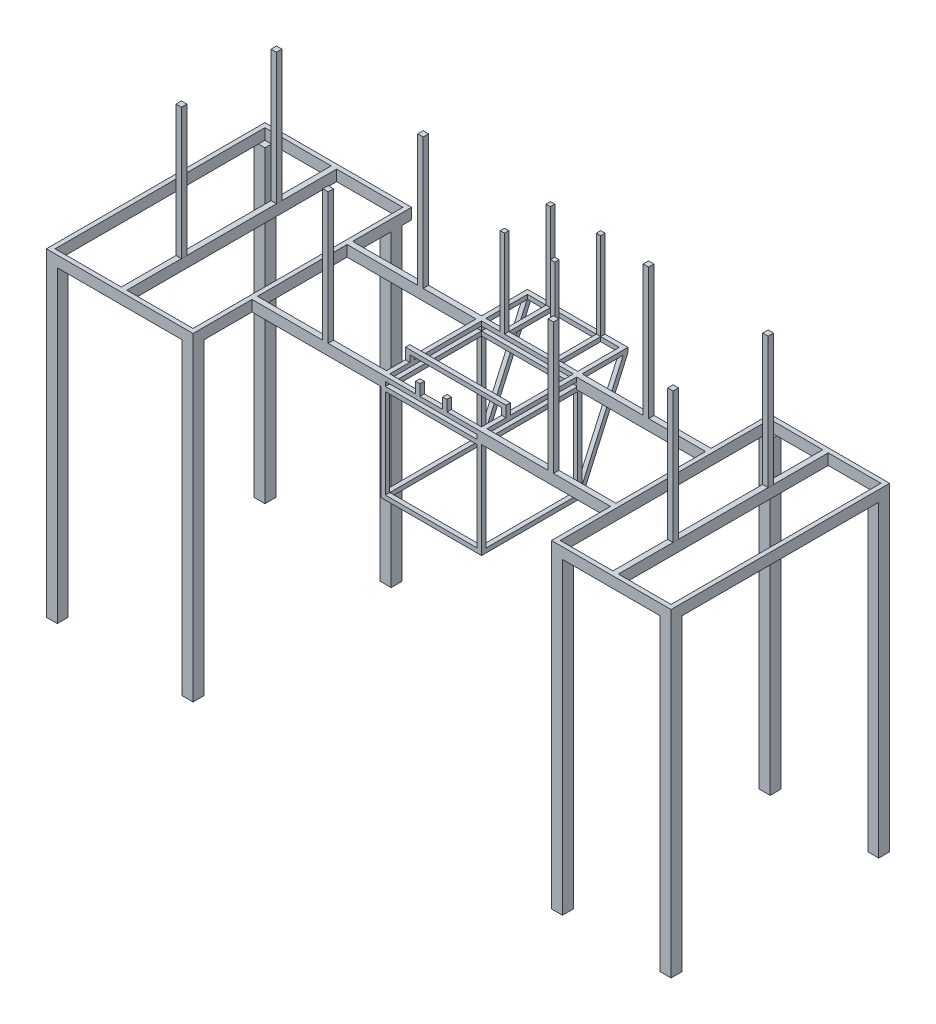
from build123d import *

# Parameters (mm, degrees)
CROQUIS1_W               = 460
CROQUIS1_H               = 460
CROQUIS1_W_2             = 420
CROQUIS1_H_2             = 420
SALIENTE_EXTRUIR1_DEPTH  = 20
CROQUIS2_W               = 20
CROQUIS2_H               = 20
SALIENTE_EXTRUIR2_DEPTH  = 20
CROQUIS3_W               = 460
CROQUIS3_H               = 460
CROQUIS3_W_2             = 420
CROQUIS3_H_2             = 420
SALIENTE_EXTRUIR3_DEPTH  = 20
CROQUIS4_W               = 20
CROQUIS4_H               = 20
SALIENTE_EXTRUIR4_DEPTH  = 410
CROQUIS5_W               = 460
CROQUIS5_H               = 460
CROQUIS5_W_2             = 420
CROQUIS5_H_2             = 420
SALIENTE_EXTRUIR5_DEPTH  = 20
CROQUIS7_W               = 25
CROQUIS7_H               = 50
SALIENTE_EXTRUIR7_DEPTH  = 590
CROQUIS8_W               = 25
CROQUIS8_H               = 50
SALIENTE_EXTRUIR8_DEPTH  = 590
CROQUIS9_W               = 25
CROQUIS9_H               = 25
SALIENTE_EXTRUIR9_DEPTH  = 600
CROQUIS10_W              = 671
CROQUIS10_H              = 1000
CROQUIS10_W_2            = 303
CROQUIS10_H_2            = 960
CROQUIS10_W_3            = 547
CROQUIS10_W_4            = 241
SALIENTE_EXTRUIR10_DEPTH = 50
CROQUIS11_W              = 50
CROQUIS11_H              = 50
SALIENTE_EXTRUIR11_DEPTH = 1410
CROQUIS13_W              = 20
CROQUIS13_H              = 20
SALIENTE_EXTRUIR12_DEPTH = 210
CROQUIS14_W              = 20
CROQUIS14_H              = 20
SALIENTE_EXTRUIR13_DEPTH = 210
CROQUIS15_W              = 20
CROQUIS15_H              = 20
SALIENTE_EXTRUIR14_DEPTH = 50
CROQUIS16_W              = 20
CROQUIS16_H              = 20
SALIENTE_EXTRUIR15_DEPTH = 400
CROQUIS17_W              = 460
CROQUIS17_H              = 230
CROQUIS17_W_2            = 420
CROQUIS17_H_2            = 190
SALIENTE_EXTRUIR16_DEPTH = 20
SALIENTE_EXTRUIR17_DEPTH = 20
SALIENTE_EXTRUIR18_DEPTH = 20
CROQUIS23_W              = 20
CROQUIS23_H              = 20
SALIENTE_EXTRUIR22_DEPTH = 50
CROQUIS24_W              = 20
CROQUIS24_H              = 20
SALIENTE_EXTRUIR23_DEPTH = 420


with BuildPart() as part:
    # Croquis1 → Saliente-Extruir1 (new body)
    with BuildSketch(Plane(origin=(0, 0, 0), x_dir=(1, 0, 0), z_dir=(0, 1, 0))):
        with Locations((230, 230)):
            Rectangle(CROQUIS1_W, CROQUIS1_H)
        with Locations((230, 230)):
            Rectangle(CROQUIS1_W_2, CROQUIS1_H_2, mode=Mode.SUBTRACT)
    extrude(amount=SALIENTE_EXTRUIR1_DEPTH)

    # Croquis2 → Saliente-Extruir2 (add)
    with BuildSketch(Plane.XZ):
        with Locations((10, -10)):
            Rectangle(CROQUIS2_W, CROQUIS2_H)
        with Locations((10, -450)):
            Rectangle(CROQUIS2_W, CROQUIS2_H)
        with Locations((450, -450)):
            Rectangle(CROQUIS2_W, CROQUIS2_H)
        with Locations((450, -10)):
            Rectangle(CROQUIS2_W, CROQUIS2_H)
    extrude(amount=SALIENTE_EXTRUIR2_DEPTH)

    # Croquis3 → Saliente-Extruir3 (add)
    with BuildSketch(Plane.XZ.offset(20)):
        with Locations((230, -230)):
            Rectangle(CROQUIS3_W, CROQUIS3_H)
        with Locations((230, -230)):
            Rectangle(CROQUIS3_W_2, CROQUIS3_H_2, mode=Mode.SUBTRACT)
    extrude(amount=SALIENTE_EXTRUIR3_DEPTH)

    # Croquis4 → Saliente-Extruir4 (add)
    with BuildSketch(Plane.XZ.offset(40)):
        with Locations((10, -10)):
            Rectangle(CROQUIS4_W, CROQUIS4_H)
        with Locations((10, -450)):
            Rectangle(CROQUIS4_W, CROQUIS4_H)
        with Locations((450, -450)):
            Rectangle(CROQUIS4_W, CROQUIS4_H)
        with Locations((450, -10)):
            Rectangle(CROQUIS4_W, CROQUIS4_H)
    extrude(amount=SALIENTE_EXTRUIR4_DEPTH)

    # Croquis5 → Saliente-Extruir5 (add)
    with BuildSketch(Plane.XZ.offset(450)):
        with Locations((230, -230)):
            Rectangle(CROQUIS5_W, CROQUIS5_H)
        with Locations((230, -230)):
            Rectangle(CROQUIS5_W_2, CROQUIS5_H_2, mode=Mode.SUBTRACT)
    extrude(amount=SALIENTE_EXTRUIR5_DEPTH)

    # Croquis7 → Saliente-Extruir7 (add)
    with BuildSketch(Plane.ZY):
        with Locations((-12.5, -5)):
            Rectangle(CROQUIS7_W, CROQUIS7_H)
        with Locations((-447.5, -5)):
            Rectangle(CROQUIS7_W, CROQUIS7_H)
    extrude(amount=SALIENTE_EXTRUIR7_DEPTH)

    # Croquis8 → Saliente-Extruir8 (add)
    with BuildSketch(Plane(origin=(460, 0, 0), x_dir=(0, 0, -1), z_dir=(1, 0, 0))):
        with Locations((12.5, -5)):
            Rectangle(CROQUIS8_W, CROQUIS8_H)
        with Locations((447.5, -5)):
            Rectangle(CROQUIS8_W, CROQUIS8_H)
    extrude(amount=SALIENTE_EXTRUIR8_DEPTH)

    # Croquis9 → Saliente-Extruir9 (add)
    with BuildSketch(Plane(origin=(0, 20, 0), x_dir=(1, 0, 0), z_dir=(0, 1, 0))):
        with Locations((-254.5, 447.5)):
            Rectangle(CROQUIS9_W, CROQUIS9_H)
        with Locations((-254.5, 12.5)):
            Rectangle(CROQUIS9_W, CROQUIS9_H)
        with Locations((776.5, 447.5)):
            Rectangle(CROQUIS9_W, CROQUIS9_H)
        with Locations((776.5, 12.5)):
            Rectangle(CROQUIS9_W, CROQUIS9_H)
        with Locations((-925.5, 12.5)):
            Rectangle(CROQUIS9_W, CROQUIS9_H)
        with Locations((-925.5, 447.5)):
            Rectangle(CROQUIS9_W, CROQUIS9_H)
        with Locations((1323.5, 12.5)):
            Rectangle(CROQUIS9_W, CROQUIS9_H)
        with Locations((1323.5, 447.5)):
            Rectangle(CROQUIS9_W, CROQUIS9_H)
    extrude(amount=SALIENTE_EXTRUIR9_DEPTH)


with BuildPart() as saliente_extruir9_piece_1:
    # of the separate pieces the step leaves, piece 1, a body of its own (saliente_extruir9_pieces)
    add(part.part.solids().sort_by_distance((0, -30, 0))[0])

    # Croquis10 → Saliente-Extruir10 (add)
    # profile 1 of 2: a face of its own
    with BuildSketch(Plane(origin=(0, 20, 0), x_dir=(1, 0, 0), z_dir=(0, 1, 0))):
        with Locations((-925.5, 230)):
            Rectangle(CROQUIS10_W, CROQUIS10_H)
        with Locations((-761.5, 230)):
            Rectangle(CROQUIS10_W_2, CROQUIS10_H_2, mode=Mode.SUBTRACT)
        with Locations((-1089.5, 230)):
            Rectangle(CROQUIS10_W_2, CROQUIS10_H_2, mode=Mode.SUBTRACT)
    # profile 2 of 2: a face of its own
    with BuildSketch(Plane(origin=(0, 20, 0), x_dir=(1, 0, 0), z_dir=(0, 1, 0))):
        with Locations((1323.5, 230)):
            Rectangle(CROQUIS10_W_3, CROQUIS10_H)
        with Locations((1190.5, 230)):
            Rectangle(CROQUIS10_W_4, CROQUIS10_H_2, mode=Mode.SUBTRACT)
        with Locations((1456.5, 230)):
            Rectangle(CROQUIS10_W_4, CROQUIS10_H_2, mode=Mode.SUBTRACT)
    extrude(amount=-SALIENTE_EXTRUIR10_DEPTH)

    # Croquis11 → Saliente-Extruir11 (add)
    with BuildSketch(Plane.XZ.offset(30)):
        with Locations((-1236, 245)):
            Rectangle(CROQUIS11_W, CROQUIS11_H)
        with Locations((-615, 245)):
            Rectangle(CROQUIS11_W, CROQUIS11_H)
        with Locations((-615, -661.477179098)):
            Rectangle(CROQUIS11_W, CROQUIS11_H)
        with Locations((-1236, -705)):
            Rectangle(CROQUIS11_W, CROQUIS11_H)
        with Locations((1075, -705)):
            Rectangle(CROQUIS11_W, CROQUIS11_H)
        with Locations((1572, -705)):
            Rectangle(CROQUIS11_W, CROQUIS11_H)
        with Locations((1572, 245)):
            Rectangle(CROQUIS11_W, CROQUIS11_H)
        with Locations((1075, 245)):
            Rectangle(CROQUIS11_W, CROQUIS11_H)
    extrude(amount=SALIENTE_EXTRUIR11_DEPTH)

    # Croquis13 → Saliente-Extruir12 (add)
    with BuildSketch(Plane(origin=(0, 0, -460), x_dir=(-1, 0, 0), z_dir=(0, 0, -1))):
        with Locations((-345, 10)):
            Rectangle(CROQUIS13_W, CROQUIS13_H)
        with Locations((-115, 10)):
            Rectangle(CROQUIS13_W, CROQUIS13_H)
    extrude(amount=SALIENTE_EXTRUIR12_DEPTH)

    # Croquis14 → Saliente-Extruir13 (add)
    with BuildSketch(Plane(origin=(125, 0, 0), x_dir=(0, 0, -1), z_dir=(1, 0, 0))):
        with Locations((660, 10)):
            Rectangle(CROQUIS14_W, CROQUIS14_H)
    extrude(amount=SALIENTE_EXTRUIR13_DEPTH)

    # Croquis15 → Saliente-Extruir14 (add)
    with BuildSketch(Plane(origin=(0, 20, 0), x_dir=(1, 0, 0), z_dir=(0, 1, 0))):
        with Locations((292, 10)):
            Rectangle(CROQUIS15_W, CROQUIS15_H)
        with Locations((168, 10)):
            Rectangle(CROQUIS15_W, CROQUIS15_H)
    extrude(amount=SALIENTE_EXTRUIR14_DEPTH)

    # Croquis16 → Saliente-Extruir15 (add)
    with BuildSketch(Plane(origin=(0, 20, 0), x_dir=(1, 0, 0), z_dir=(0, 1, 0))):
        with Locations((345, 660)):
            Rectangle(CROQUIS16_W, CROQUIS16_H)
        with Locations((115, 660)):
            Rectangle(CROQUIS16_W, CROQUIS16_H)
        with Locations((345, 450)):
            Rectangle(CROQUIS16_W, CROQUIS16_H)
        with Locations((115, 450)):
            Rectangle(CROQUIS16_W, CROQUIS16_H)
    extrude(amount=SALIENTE_EXTRUIR15_DEPTH)

    # Croquis17 → Saliente-Extruir16 (add)
    with BuildSketch(Plane(origin=(0, 20, 0), x_dir=(1, 0, 0), z_dir=(0, 1, 0))):
        with Locations((230, 555)):
            Rectangle(CROQUIS17_W, CROQUIS17_H)
        with Locations((230, 555)):
            Rectangle(CROQUIS17_W_2, CROQUIS17_H_2, mode=Mode.SUBTRACT)
    extrude(amount=-SALIENTE_EXTRUIR16_DEPTH)

    # Croquis18 → Saliente-Extruir17 (add)
    with BuildSketch(Plane.ZY):
        Polygon((-670, 0), (-460, -470), (-441.739825788, -461.841198756), (-651.739825788, 8.158801244), align=None)
    extrude(amount=-SALIENTE_EXTRUIR17_DEPTH)

    # Croquis19 → Saliente-Extruir18 (add)
    with BuildSketch(Plane(origin=(460, 0, 0), x_dir=(0, 0, -1), z_dir=(1, 0, 0))):
        Polygon((670, 0), (460, -470), (441.739825788, -461.841198756), (651.739825788, 8.158801244), align=None)
    extrude(amount=-SALIENTE_EXTRUIR18_DEPTH)

    # Croquis23 → Saliente-Extruir22 (add)
    with BuildSketch(Plane(origin=(0, 20, 0), x_dir=(1, 0, 0), z_dir=(0, 1, 0))):
        with Locations((10, 122)):
            Rectangle(CROQUIS23_W, CROQUIS23_H)
        with Locations((450, 122)):
            Rectangle(CROQUIS23_W, CROQUIS23_H)
    extrude(amount=SALIENTE_EXTRUIR22_DEPTH)

    # Croquis24 → Saliente-Extruir23 (add)
    with BuildSketch(Plane.ZY.offset(-440)):
        with Locations((-122, 60)):
            Rectangle(CROQUIS24_W, CROQUIS24_H)
    extrude(amount=SALIENTE_EXTRUIR23_DEPTH)


with BuildPart() as saliente_extruir9_piece_2:
    # of the separate pieces the step leaves, piece 2, a body of its own (saliente_extruir9_pieces)
    add(part.part.solids().sort_by_distance((1311, 20, -460))[0])


with BuildPart() as saliente_extruir9_piece_3:
    # of the separate pieces the step leaves, piece 3, a body of its own (saliente_extruir9_pieces)
    add(part.part.solids().sort_by_distance((-913, 20, 0))[0])


with BuildPart() as saliente_extruir9_piece_4:
    # of the separate pieces the step leaves, piece 4, a body of its own (saliente_extruir9_pieces)
    add(part.part.solids().sort_by_distance((1311, 20, -25))[0])


with BuildPart() as saliente_extruir9_piece_5:
    # of the separate pieces the step leaves, piece 5, a body of its own (saliente_extruir9_pieces)
    add(part.part.solids().sort_by_distance((-938, 20, -460))[0])


solid = Compound([saliente_extruir9_piece_1.part, saliente_extruir9_piece_2.part, saliente_extruir9_piece_3.part, saliente_extruir9_piece_4.part, saliente_extruir9_piece_5.part])
